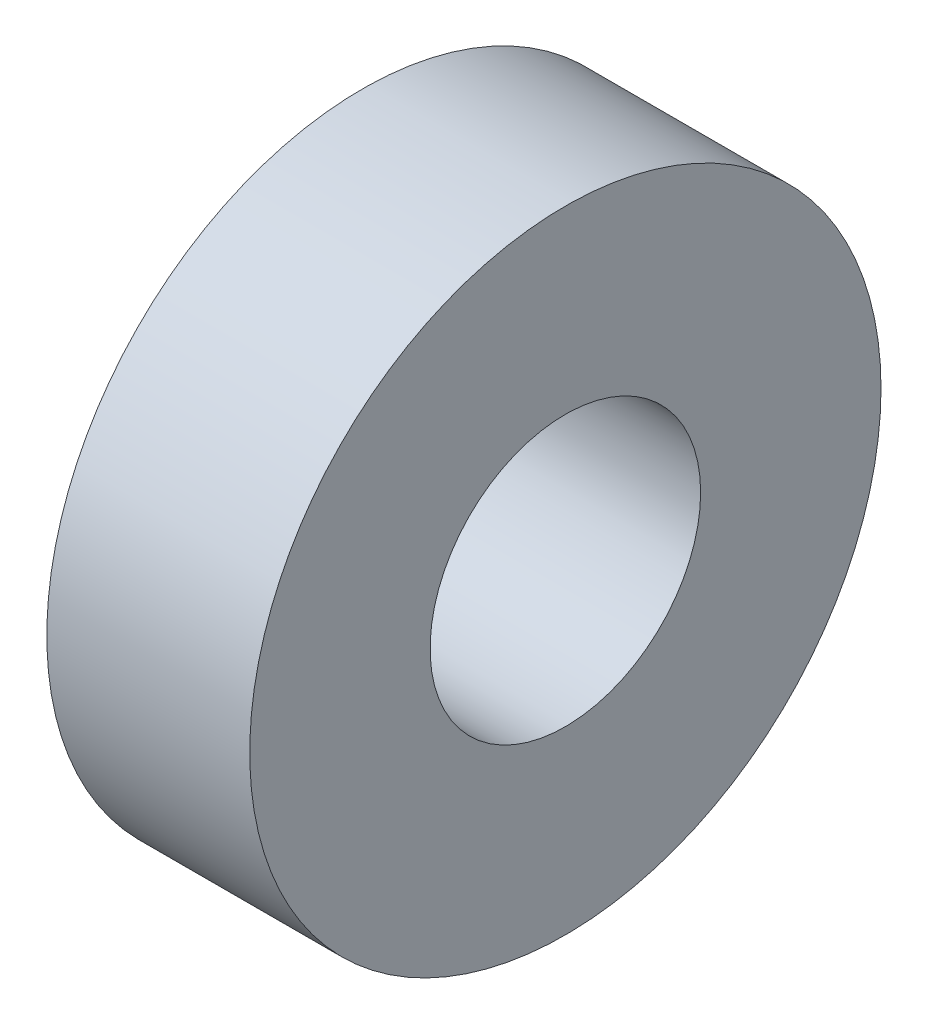
from build123d import *

# Parameters (mm, degrees)
SKETCH1_R           = 88.9
SKETCH1_R_2         = 38.1
BOSS_EXTRUDE1_DEPTH = 28.575


with BuildPart() as part:
    # Sketch1 → Boss-Extrude1 (new, symmetric)
    with BuildSketch(Plane(origin=(0, 0, 0), x_dir=(0, 0, -1), z_dir=(1, 0, 0))):
        Circle(SKETCH1_R)
        Circle(SKETCH1_R_2, mode=Mode.SUBTRACT)
    extrude(amount=BOSS_EXTRUDE1_DEPTH, both=True)


solid = part.part
